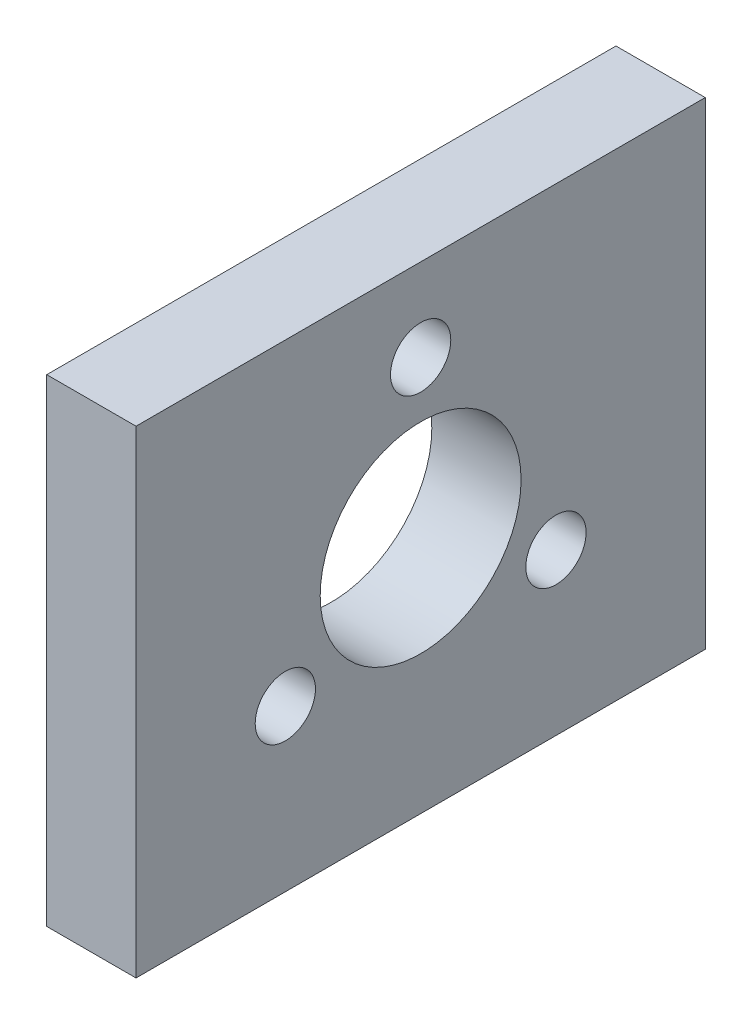
from build123d import *

# Parameters (mm, degrees)
SKETCH2_W                  = 25.50248159
SKETCH2_H                  = 21.40954602
BOSS_EXTRUDE1_DEPTH        = 4
M2_5_CLEARANCE_HOLE1_D     = 2.7
M2_5_CLEARANCE_HOLE1_DEPTH = 6.65
M2_5_CLEARANCE_HOLE1_TIP   = 0.811161836
SKETCH6_R                  = 4.5
CUT_EXTRUDE1_DEPTH         = 18.12268399


with BuildPart() as part:
    # Sketch2 → Boss-Extrude1 (new body)
    with BuildSketch(Plane(origin=(0, 0, 0), x_dir=(0, 0, -1), z_dir=(1, 0, 0))):
        Rectangle(SKETCH2_W, SKETCH2_H)
    extrude(amount=BOSS_EXTRUDE1_DEPTH)

    # M2.5 Clearance Hole1
    with Locations(Plane.ZY):
        with Locations((0, 7), (-6.062177826, -3.5), (6.062177826, -3.5)):
            Hole(M2_5_CLEARANCE_HOLE1_D / 2, depth=M2_5_CLEARANCE_HOLE1_DEPTH)
            with Locations((0, 0, -(M2_5_CLEARANCE_HOLE1_DEPTH + M2_5_CLEARANCE_HOLE1_TIP / 2))):  # 118° drill point
                Cone(0, M2_5_CLEARANCE_HOLE1_D / 2, M2_5_CLEARANCE_HOLE1_TIP, mode=Mode.SUBTRACT)

    # Sketch6 → Cut-Extrude1 (cut, through all)
    with BuildSketch(Plane.ZY):
        Circle(SKETCH6_R)
    extrude(amount=-CUT_EXTRUDE1_DEPTH, mode=Mode.SUBTRACT)


solid = part.part
